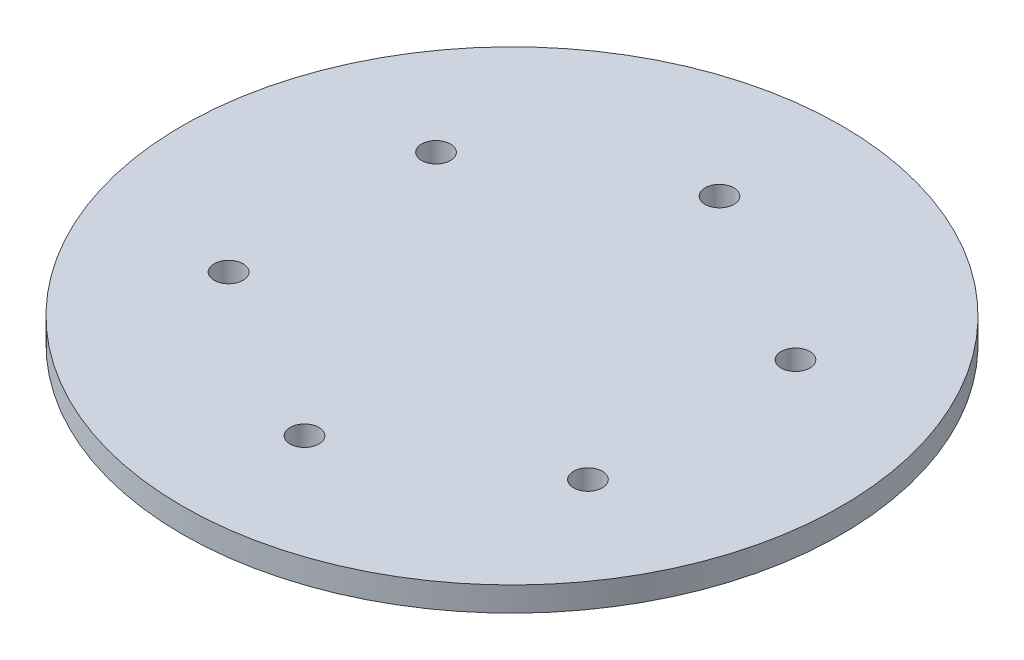
from build123d import *

# Parameters (mm, degrees)
SKETCH1_R           = 67.5
BOSS_EXTRUDE1_DEPTH = 2.5
SKETCH2_R           = 2.95
CUT_EXTRUDE1_DEPTH  = 5


with BuildPart() as part:
    # Sketch1 → Boss-Extrude1 (new, symmetric)
    with BuildSketch(Plane(origin=(0, 0, 0), x_dir=(1, 0, 0), z_dir=(0, 1, 0))):
        with Locations(Location((0, 0, 0), (0, 0, 270))):
            Circle(SKETCH1_R)
    extrude(amount=BOSS_EXTRUDE1_DEPTH, both=True)

    # Sketch2 → Cut-Extrude1 (cut)
    with BuildSketch(Plane(origin=(0, 2.5, 0), x_dir=(1, 0, 0), z_dir=(0, 1, 0))):
        with Locations(Location((0, 42.5, 0), (0, 0, 270))):
            Circle(SKETCH2_R)
        with Locations(Location((36.806079661, 21.25, 0), (0, 0, 270))):
            Circle(SKETCH2_R)
        with Locations(Location((36.806079661, -21.25, 0), (0, 0, 270))):
            Circle(SKETCH2_R)
        with Locations(Location((0, -42.5, 0), (0, 0, 270))):
            Circle(SKETCH2_R)
        with Locations(Location((-36.806079661, -21.25, 0), (0, 0, 270))):
            Circle(SKETCH2_R)
        with Locations(Location((-36.806079661, 21.25, 0), (0, 0, 270))):
            Circle(SKETCH2_R)
    extrude(amount=-CUT_EXTRUDE1_DEPTH, mode=Mode.SUBTRACT)


solid = part.part
